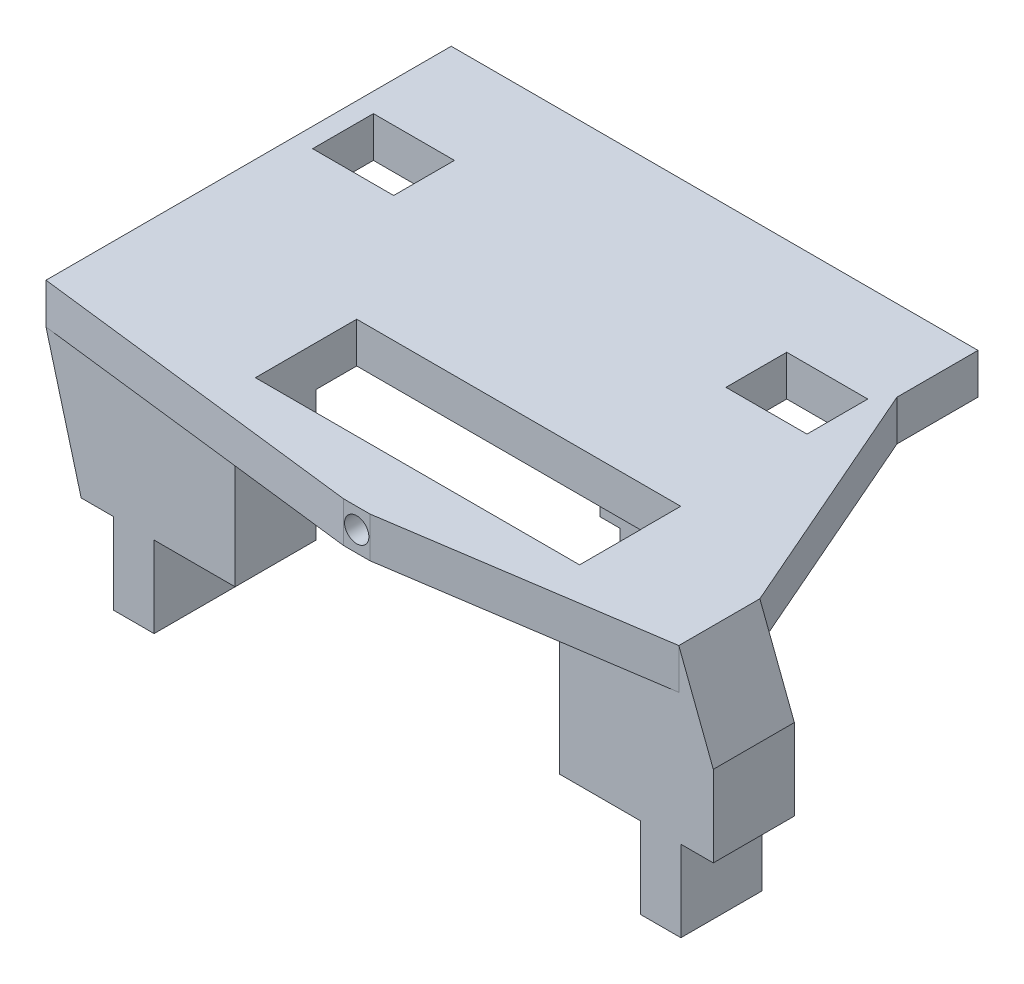
from build123d import *

# Parameters (mm, degrees)
SALIENTE_EXTRUIR1_DEPTH  = 10
CROQUIS2_W               = 5
CROQUIS2_H               = 45
CORTAR_EXTRUIR1_DEPTH    = 12.5
CROQUIS4_W               = 73.322426794
CROQUIS4_H               = 5
SALIENTE_EXTRUIR2_DEPTH  = 30
CROQUIS5_W               = 2.5
CROQUIS5_H               = 5
SALIENTE_EXTRUIR3_DEPTH  = 50
CROQUIS6_W               = 55.637494131
CROQUIS6_H               = 64.414873678
CORTAR_EXTRUIR2_DEPTH    = 55
CROQUIS7_R               = 1.5
CORTAR_EXTRUIR3_DEPTH    = 5
CROQUIS8_W               = 39.981329184
CROQUIS8_H               = 5
CORTAR_EXTRUIR4_DEPTH    = 10
CROQUIS9_W               = 10
CROQUIS9_H               = 7.5
SALIENTE_EXTRUIR4_DEPTH  = 21
CROQUIS11_R              = 2
CORTAR_EXTRUIR5_DEPTH    = 21
SALIENTE_EXTRUIR5_START  = -40
CROQUIS12_W              = 21.008716652
CROQUIS12_H              = 5
SALIENTE_EXTRUIR5_DEPTH  = 40
CORTAR_EXTRUIR6_DEPTH    = 62.200166864
CROQUIS15_W              = 5
CROQUIS15_H              = 10
SALIENTE_EXTRUIR6_DEPTH  = 31.1
SALIENTE_EXTRUIR7_DEPTH  = 10
SALIENTE_EXTRUIR8_DEPTH  = 5
CORTAR_EXTRUIR7_START    = -13
CROQUIS21_R              = 1.5
CORTAR_EXTRUIR7_DEPTH    = 13
CROQUIS22_W              = 10
CROQUIS22_H              = 7.5
CORTAR_EXTRUIR14_DEPTH   = 75.112484941
CROQUIS26_W              = 65
CROQUIS26_H              = 5
SALIENTE_EXTRUIR11_DEPTH = 10
SALIENTE_EXTRUIR12_DEPTH = 5
CORTAR_EXTRUIR15_START   = -10
CROQUIS28_R              = 1.5
CORTAR_EXTRUIR15_DEPTH   = 10
CROQUIS29_W              = 10
CROQUIS29_H              = 16.1
SALIENTE_EXTRUIR13_DEPTH = 5


with BuildPart() as part:
    # Croquis1 → Saliente-Extruir1 (new body)
    with BuildSketch(Plane.XY):
        with BuildLine():
            Line((-35, 10), (-35, 0))
            Line((-35, 0), (-30, 0))
            Line((-30, 0), (-30, 10))
            Line((-30, 10), (-20, 10))
            Line((-20, 10), (-20, 35.723707224))
            ThreePointArc((-20, 35.723707224), (0, 55.723707224), (20, 35.723707224))
            Line((20, 35.723707224), (20, 10))
            Line((20, 10), (30, 10))
            Line((30, 10), (30, 0))
            Line((30, 0), (35, 0))
            Line((35, 0), (35, 10))
            Line((35, 10), (39, 10))
            Line((39, 10), (39, 20))
            Line((39, 20), (14.443351433, 84.048407017))
            Line((14.443351433, 84.048407017), (13.447706691, 86.645237749))
            ThreePointArc((13.447706691, 86.645237749), (0, 95), (-13.447706691, 86.645237749))
            Line((-13.447706691, 86.645237749), (-14.443351433, 84.048407017))
            Line((-14.443351433, 84.048407017), (-39, 20))
            Line((-39, 20), (-39, 10))
            Line((-39, 10), (-35, 10))
        make_face()
        with BuildLine():
            ThreePointArc((1.5, 60), (0, 58.5), (-1.5, 60))
            Line((-1.5, 60), (-1.5, 80))
            ThreePointArc((-1.5, 80), (0, 81.5), (1.5, 80))
            Line((1.5, 80), (1.5, 60))
        make_face(mode=Mode.SUBTRACT)
    extrude(amount=SALIENTE_EXTRUIR1_DEPTH)

    # Croquis2 → Cortar-Extruir1 (cut, symmetric)
    with BuildSketch(Plane(origin=(0, 0, 0), x_dir=(0, 0, -1), z_dir=(1, 0, 0))):
        with Locations((-5, 72.5)):
            Rectangle(CROQUIS2_W, CROQUIS2_H)
    extrude(amount=CORTAR_EXTRUIR1_DEPTH, both=True, mode=Mode.SUBTRACT)

    # Croquis4 → Saliente-Extruir2 (add)
    with BuildSketch(Plane(origin=(0, 0, 0), x_dir=(-1, 0, 0), z_dir=(0, 0, -1))):
        with Locations((0, 28.6)):
            Rectangle(CROQUIS4_W, CROQUIS4_H)
    extrude(amount=SALIENTE_EXTRUIR2_DEPTH)

    # Croquis5 → Saliente-Extruir3 (add)
    with BuildSketch(Plane(origin=(-20, 0, 0), x_dir=(0, 0, -1), z_dir=(1, 0, 0))):
        with Locations((-8.75, 28.6)):
            Rectangle(CROQUIS5_W, CROQUIS5_H)
    extrude(amount=SALIENTE_EXTRUIR3_DEPTH)

    # Croquis6 → Cortar-Extruir2 (cut, symmetric)
    with BuildSketch(Plane(origin=(-20, 0, 0), x_dir=(0, 0, -1), z_dir=(1, 0, 0))):
        with Locations((17.818747066, 63.307436839)):
            Rectangle(CROQUIS6_W, CROQUIS6_H)
    extrude(amount=CORTAR_EXTRUIR2_DEPTH, both=True, mode=Mode.SUBTRACT)

    # Croquis7 → Cortar-Extruir3 (cut)
    with BuildSketch(Plane.XY.offset(10)):
        with Locations((0, 28.6)):
            Circle(CROQUIS7_R)
    extrude(amount=-CORTAR_EXTRUIR3_DEPTH, mode=Mode.SUBTRACT)

    # Croquis8 → Cortar-Extruir4 (cut)
    with BuildSketch(Plane(origin=(0, 31.1, 0), x_dir=(1, 0, 0), z_dir=(0, 1, 0))):
        with Locations((-0.009335408, 2.5)):
            Rectangle(CROQUIS8_W, CROQUIS8_H)
    extrude(amount=-CORTAR_EXTRUIR4_DEPTH, mode=Mode.SUBTRACT)

    # Croquis9 → Saliente-Extruir4 (add)
    with BuildSketch(Plane(origin=(0, 31.1, 0), x_dir=(1, 0, 0), z_dir=(0, 1, 0))):
        with Locations((15.061213397, 24.25)):
            Rectangle(CROQUIS9_W, CROQUIS9_H)
        with Locations((-35.940317185, 24.25)):
            Rectangle(CROQUIS9_W, CROQUIS9_H)
    extrude(amount=SALIENTE_EXTRUIR4_DEPTH)

    # Croquis11 → Cortar-Extruir5 (cut)
    with BuildSketch(Plane.XY.offset(-20.5)):
        with Locations((13.560448106, 46.6)):
            Circle(CROQUIS11_R)
        with Locations((13.560448106, 35.6)):
            Circle(CROQUIS11_R)
        with Locations((-34.439551894, 46.6)):
            Circle(CROQUIS11_R)
        with Locations((-34.439551894, 35.6)):
            Circle(CROQUIS11_R)
    extrude(amount=-CORTAR_EXTRUIR5_DEPTH, mode=Mode.SUBTRACT)

    # Croquis12 → Saliente-Extruir5 (add)
    with BuildSketch(Plane(origin=(0, 0, -30), x_dir=(-1, 0, 0), z_dir=(0, 0, -1)).offset(SALIENTE_EXTRUIR5_START)):
        with Locations((32.834428277, 28.6)):
            Rectangle(CROQUIS12_W, CROQUIS12_H)
    extrude(amount=SALIENTE_EXTRUIR5_DEPTH)

    # Croquis13 → Cortar-Extruir6 (cut, through all)
    with BuildSketch(Plane(origin=(0, 31.1, 0), x_dir=(1, 0, 0), z_dir=(0, 1, 0))):
        Polygon((34.744175198, 0), (36.661213397, 0), (36.661213397, 30), (21.661213397, 30), align=None)
    extrude(amount=-CORTAR_EXTRUIR6_DEPTH, mode=Mode.SUBTRACT)

    # Croquis15 → Saliente-Extruir6 (add)
    with BuildSketch(Plane(origin=(0, 31.1, 0), x_dir=(1, 0, 0), z_dir=(0, 1, 0))):
        with Locations((0, 25)):
            Rectangle(CROQUIS15_W, CROQUIS15_H)
    extrude(amount=-SALIENTE_EXTRUIR6_DEPTH)

    # Croquis18 → Saliente-Extruir7 (add)
    with BuildSketch(Plane.XY.offset(10)):
        Polygon((-39, 10), (-43.338786603, 26.1), (-36.661213397, 26.1), align=None)
    extrude(amount=-SALIENTE_EXTRUIR7_DEPTH)

    # Croquis22 → Cortar-Extruir14 (cut, through all)
    with BuildSketch(Plane(origin=(0, 52.1, 0), x_dir=(1, 0, 0), z_dir=(0, 1, 0))):
        with Locations((-35.940317185, 24.25)):
            Rectangle(CROQUIS22_W, CROQUIS22_H)
        with Locations((15.061213397, 24.25)):
            Rectangle(CROQUIS22_W, CROQUIS22_H)
    extrude(amount=-CORTAR_EXTRUIR14_DEPTH, mode=Mode.SUBTRACT)

    # Croquis26 → Saliente-Extruir11 (add)
    with BuildSketch(Plane(origin=(0, 0, -30), x_dir=(-1, 0, 0), z_dir=(0, 0, -1))):
        with Locations((10.838786603, 28.6)):
            Rectangle(CROQUIS26_W, CROQUIS26_H)
    extrude(amount=SALIENTE_EXTRUIR11_DEPTH)



with BuildPart() as body_2:
    # Croquis20 → Saliente-Extruir8 (new body)
    with BuildSketch(Plane(origin=(0, 31.1, 0), x_dir=(1, 0, 0), z_dir=(0, 1, 0))):
        Polygon((-1.624735856, -15), (1.624735856, -15), (34.744175198, -10), (-43.338786603, -10), align=None)
    extrude(amount=-SALIENTE_EXTRUIR8_DEPTH)

    # Croquis21 → Cortar-Extruir7 (cut)
    with BuildSketch(Plane(origin=(0, 0, 7.5), x_dir=(-1, 0, 0), z_dir=(0, 0, -1)).offset(CORTAR_EXTRUIR7_START)):
        with Locations((0, 28.6)):
            Circle(CROQUIS21_R)
    extrude(amount=CORTAR_EXTRUIR7_DEPTH, mode=Mode.SUBTRACT)


with BuildPart() as part_1:
    add(part.part)

    add(body_2.part)  # Saliente-Extruir12 merges body 2
    # Croquis27 → Saliente-Extruir12 (add)
    with BuildSketch(Plane(origin=(0, 31.1, 0), x_dir=(1, 0, 0), z_dir=(0, 1, 0))):
        Polygon((-43.338786603, -10), (-43.338786603, -8.609959484), (34.744175198, -8.609959484), (34.744175198, -10), (1.624735856, -15), (-1.624735856, -15), align=None)
    extrude(amount=-SALIENTE_EXTRUIR12_DEPTH)

    # Croquis28 → Cortar-Extruir15 (cut)
    with BuildSketch(Plane(origin=(0, 0, 8.609959484), x_dir=(-1, 0, 0), z_dir=(0, 0, -1)).offset(CORTAR_EXTRUIR15_START)):
        with Locations(Location((0, 28.6, 0), (0, 0, 180))):
            Circle(CROQUIS28_R)
    extrude(amount=CORTAR_EXTRUIR15_DEPTH, mode=Mode.SUBTRACT)

    # Croquis29 → Saliente-Extruir13 (add, symmetric)
    with BuildSketch(Plane.ZY):
        with Locations((-25, 18.05)):
            Rectangle(CROQUIS29_W, CROQUIS29_H)
    extrude(amount=SALIENTE_EXTRUIR13_DEPTH, both=True)


solid = part_1.part
